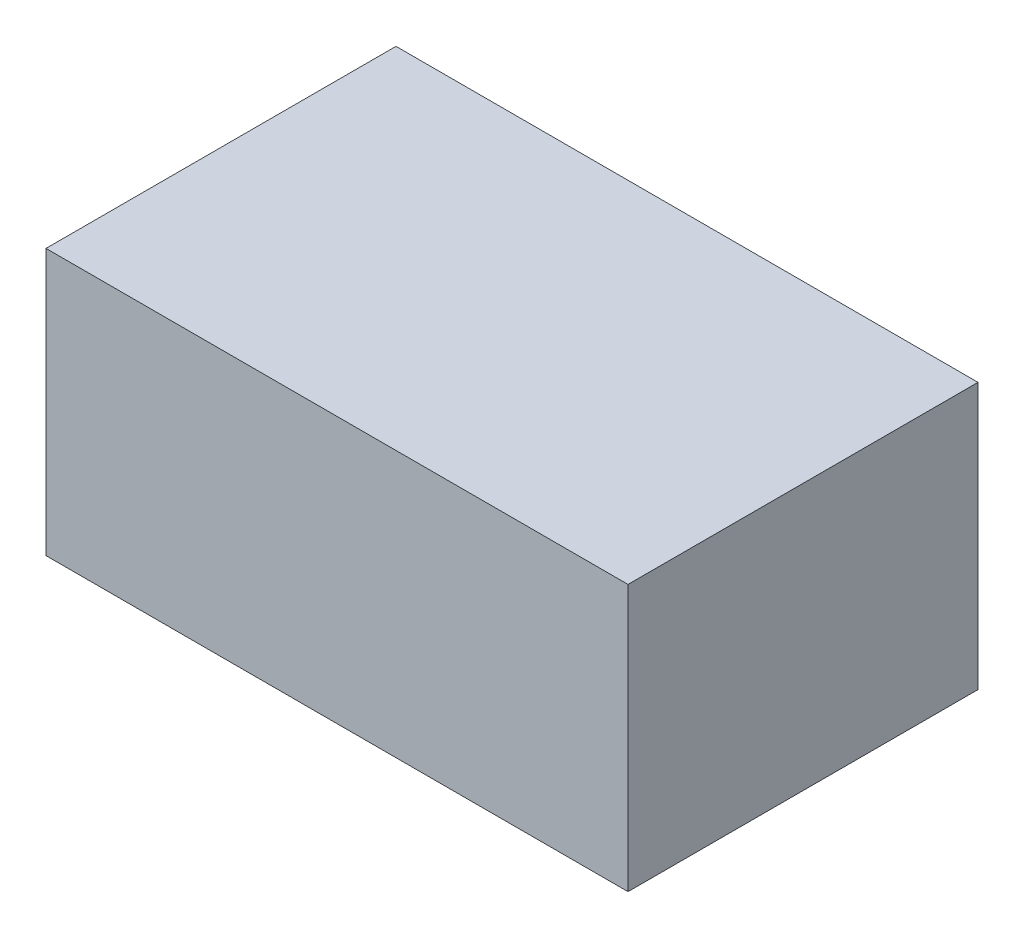
from build123d import *

# Parameters (mm, degrees)
SKETCH1_W      = 44.4
SKETCH1_H      = 20.3
ENVELOPE_DEPTH = 26.7


with BuildPart() as part:
    # Sketch1 → Envelope (new body)
    with BuildSketch(Plane.XY):
        Rectangle(SKETCH1_W, SKETCH1_H)
    extrude(amount=ENVELOPE_DEPTH)


solid = part.part
